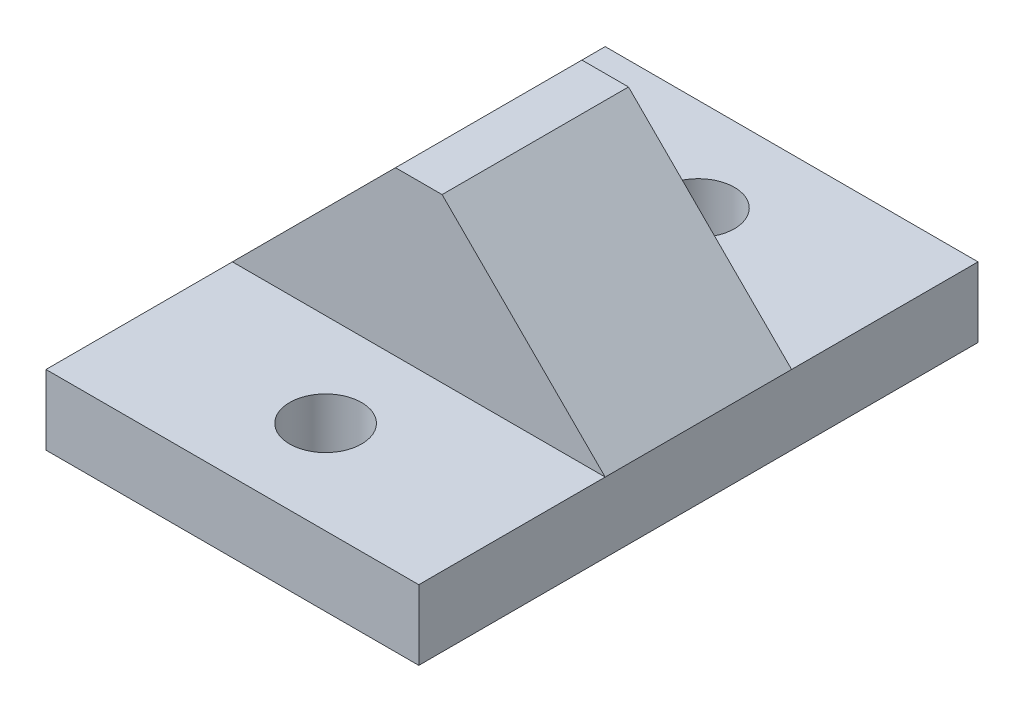
from build123d import *

# Parameters (mm, degrees)
BOSS_EXTRUDE1_DEPTH     = 38.1
CUT_EXTRUDE2_DEPTH      = 25.4
F_3_8_CLEARANCE_HOLE2_D = 9.8044


with BuildPart() as part:
    # Sketch1 → Boss-Extrude1 (new, symmetric)
    with BuildSketch(Plane.XY):
        Polygon((0, 0), (25.4, 0), (25.4, 9.525), (3.175, 31.75), (-3.175, 31.75), (-25.4, 9.525), (-25.4, 0), align=None)
    extrude(amount=BOSS_EXTRUDE1_DEPTH, both=True)

    # Sketch6 → Cut-Extrude2 (cut)
    with BuildSketch(Plane.XY.offset(38.1)):
        Polygon((-25.4, 9.525), (25.4, 9.525), (3.175, 31.75), (-3.175, 31.75), align=None)
    cut_extrude2 = extrude(amount=-CUT_EXTRUDE2_DEPTH, mode=Mode.SUBTRACT)

    # 3/8 Clearance Hole2 (through all)
    with Locations(Plane(origin=(0, 9.525, 0), x_dir=(1, 0, 0), z_dir=(0, 1, 0))):
        with Locations((0, -25.4)):
            f_3_8_clearance_hole2 = Hole(F_3_8_CLEARANCE_HOLE2_D / 2)

    # Mirror2: Cut-Extrude2, 3/8 Clearance Hole2 across plane
    add(cut_extrude2.mirror(Plane.XY), mode=Mode.SUBTRACT)
    add(f_3_8_clearance_hole2.mirror(Plane.XY), mode=Mode.SUBTRACT)


solid = part.part
